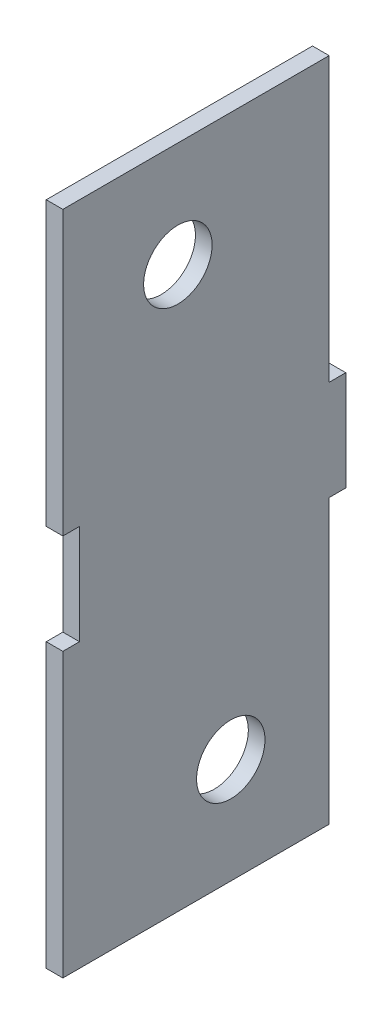
from build123d import *

# Parameters (mm, degrees)
SKETCH2_W           = 25.4
SKETCH2_H           = 63.5
SKETCH2_R           = 3.2639
BOSS_EXTRUDE1_DEPTH = 1.5875
SKETCH3_W           = 1.5875
SKETCH3_H           = 9.525
BOSS_EXTRUDE2_DEPTH = 1.5875
SKETCH3_4_W         = 1.5875
SKETCH3_4_H         = 9.525
CUT_EXTRUDE1_DEPTH  = 3.175


with BuildPart() as part:
    # Sketch2 → Boss-Extrude1 (new body)
    with BuildSketch(Plane(origin=(0, 0, 0), x_dir=(0, 0, -1), z_dir=(1, 0, 0))):
        Rectangle(SKETCH2_W, SKETCH2_H)
        with Locations((-1.72943456, 21.697785041)):
            Circle(SKETCH2_R, mode=Mode.SUBTRACT)
        with Locations((3.31693456, -21.697785041)):
            Circle(SKETCH2_R, mode=Mode.SUBTRACT)
    extrude(amount=BOSS_EXTRUDE1_DEPTH)

    # Sketch3 → Boss-Extrude2 (add)
    with BuildSketch(Plane(origin=(1.5875, 0, 0), x_dir=(0, 0, -1), z_dir=(1, 0, 0))):
        with Locations((13.49375, 0)):
            Rectangle(SKETCH3_W, SKETCH3_H)
    extrude(amount=-BOSS_EXTRUDE2_DEPTH)

    # Sketch3<4> → Cut-Extrude1 (cut)
    with BuildSketch(Plane(origin=(1.5875, 0, 0), x_dir=(0, 0, -1), z_dir=(1, 0, 0))):
        with Locations((-11.90625, 0)):
            Rectangle(SKETCH3_4_W, SKETCH3_4_H)
    extrude(amount=-CUT_EXTRUDE1_DEPTH, mode=Mode.SUBTRACT)


solid = part.part
